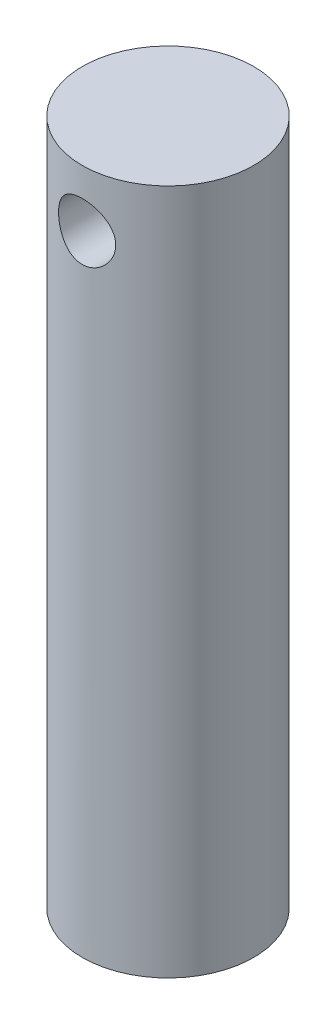
from build123d import *

# Parameters (mm, degrees)
SKETCH_1_R               = 75
EXTRUDE_1_DEPTH          = 600
CUT_EXTRUDE_1_DEPTH      = 610.302880348
CUT_EXTRUDE_1_DEPTH_BACK = 610.302880348
SKETCH_3_R               = 25


with BuildPart() as part:
    # 草图1 → 凸台-拉伸1 (new body)
    with BuildSketch(Plane(origin=(0, 0, 0), x_dir=(1, 0, 0), z_dir=(0, 1, 0))):
        with Locations(Location((0, 0, 0), (0, 0, 270))):
            Circle(SKETCH_1_R)
    extrude(amount=EXTRUDE_1_DEPTH)

    # 草图3 → 切除-拉伸1 (cut, two sides: drawn at the far end of the back side and taken through both)
    with BuildSketch(Plane.XY.offset(-CUT_EXTRUDE_1_DEPTH_BACK)):
        with Locations(Location((0, 550, 0), (0, 0, 90.000000016))):
            Circle(SKETCH_3_R)
    extrude(amount=CUT_EXTRUDE_1_DEPTH + CUT_EXTRUDE_1_DEPTH_BACK, mode=Mode.SUBTRACT)


solid = part.part
